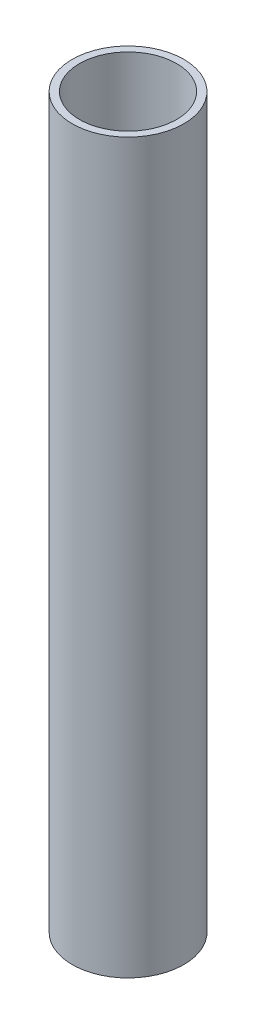
from build123d import *

# Parameters (mm, degrees)
ESQUISSE1_W = 1.5
ESQUISSE1_H = 150


with BuildPart() as part:
    # Esquisse1 → Base-Révolution (revolve)
    with BuildSketch(Plane.XY, mode=Mode.PRIVATE) as base_r_volution_sk:
        with Locations((10.75, 75)):
            Rectangle(ESQUISSE1_W, ESQUISSE1_H)
    revolve(base_r_volution_sk.sketch.rotate(Axis((0, 0, 0), (0, 1, 0)), 90), axis=Axis((0, 0, 0), (0, 1, 0)))


solid = part.part
